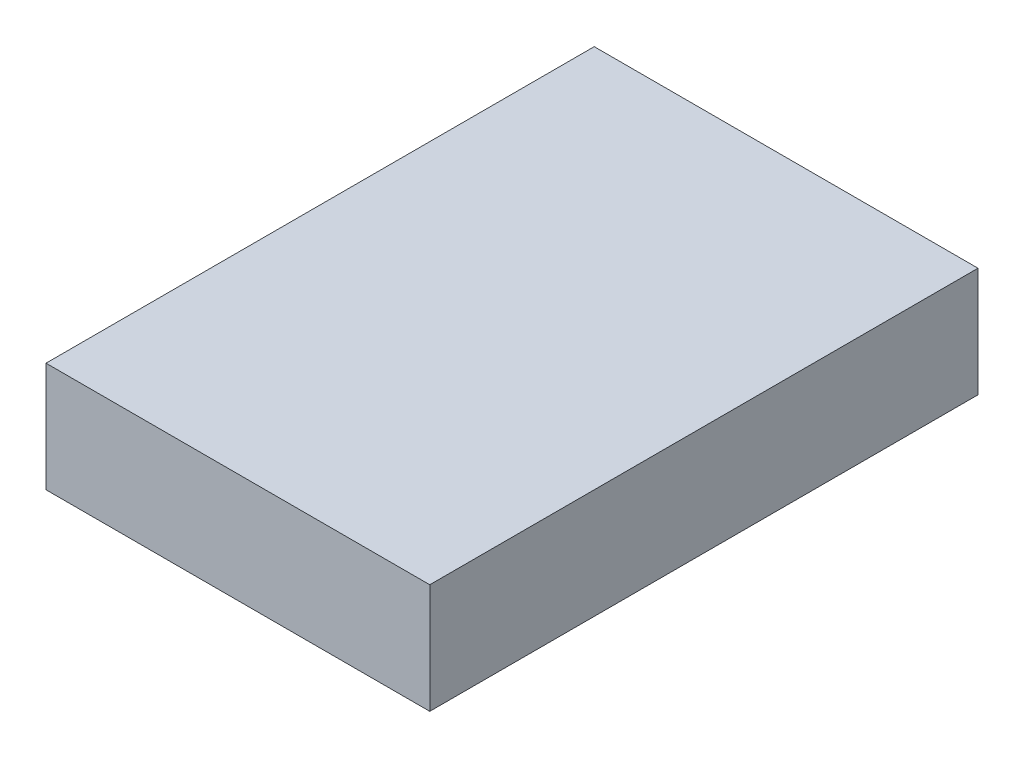
from build123d import *

# Parameters (mm, degrees)
SKETCH1_W           = 7
SKETCH1_H           = 10
BOSS_EXTRUDE1_DEPTH = 2


with BuildPart() as part:
    # Sketch1 → Boss-Extrude1 (new body)
    with BuildSketch(Plane(origin=(0, 0, 0), x_dir=(1, 0, 0), z_dir=(0, 1, 0))):
        with Locations((3.5, 5)):
            Rectangle(SKETCH1_W, SKETCH1_H)
    extrude(amount=BOSS_EXTRUDE1_DEPTH)


solid = part.part
